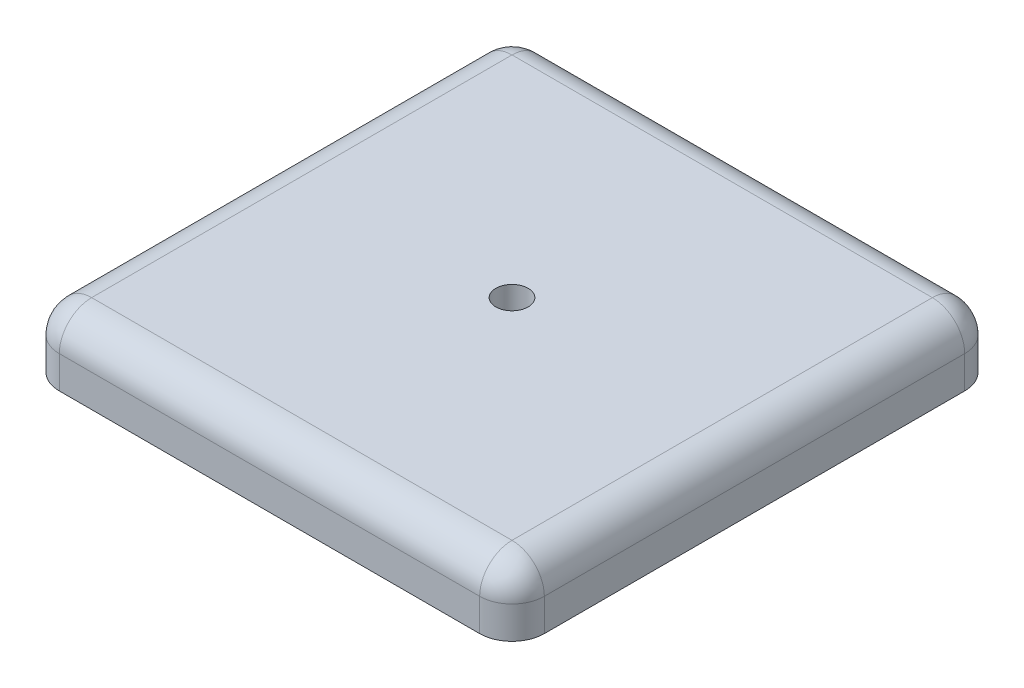
from build123d import *

# Parameters (mm, degrees)
SKETCH1_W           = 300
SKETCH1_H           = 300
BOSS_EXTRUDE1_DEPTH = 40
FILLET1_R           = 20
SKETCH2_W           = 249
SKETCH2_H           = 249
BOSS_EXTRUDE2_DEPTH = 15
SKETCH3_W           = 140
SKETCH3_H           = 60
CUT_EXTRUDE1_DEPTH  = 25
SKETCH4_R           = 10
CUT_EXTRUDE2_DEPTH  = 428.814212013


with BuildPart() as part:
    # Sketch1 → Boss-Extrude1 (new body)
    with BuildSketch(Plane(origin=(0, 0, 0), x_dir=(1, 0, 0), z_dir=(0, 1, 0))):
        with Locations((150, 150)):
            Rectangle(SKETCH1_W, SKETCH1_H)
    extrude(amount=BOSS_EXTRUDE1_DEPTH)

    # Fillet1
    fillet1_edges = [part.edges().sort_by_distance(p)[0] for p in [
        (300, 40, -150),
        (150, 40, -300),
        (0, 40, -150),
        (150, 40, 0),
        (0, 20, -300),
        (300, 20, -300),
        (300, 20, 0),
        (0, 20, 0),
    ]]
    fillet(fillet1_edges, radius=FILLET1_R)

    # Sketch2 → Boss-Extrude2 (add)
    with BuildSketch(Plane.XZ):
        with Locations((150, -150)):
            Rectangle(SKETCH2_W, SKETCH2_H)
    extrude(amount=BOSS_EXTRUDE2_DEPTH)

    # Sketch3 → Cut-Extrude1 (cut)
    with BuildSketch(Plane.XZ.offset(15)):
        with Locations((150, -90)):
            Rectangle(SKETCH3_W, SKETCH3_H)
        with Locations((150, -210)):
            Rectangle(SKETCH3_W, SKETCH3_H)
    extrude(amount=-CUT_EXTRUDE1_DEPTH, mode=Mode.SUBTRACT)

    # Sketch4 → Cut-Extrude2 (cut, through all)
    with BuildSketch(Plane(origin=(0, -15, 0), x_dir=(-1, 0, 0), z_dir=(0, -1, 0))):
        with Locations(Location((-150, 150, 0), (0, 0, 90))):
            Circle(SKETCH4_R)
    extrude(amount=-CUT_EXTRUDE2_DEPTH, mode=Mode.SUBTRACT)


solid = part.part
